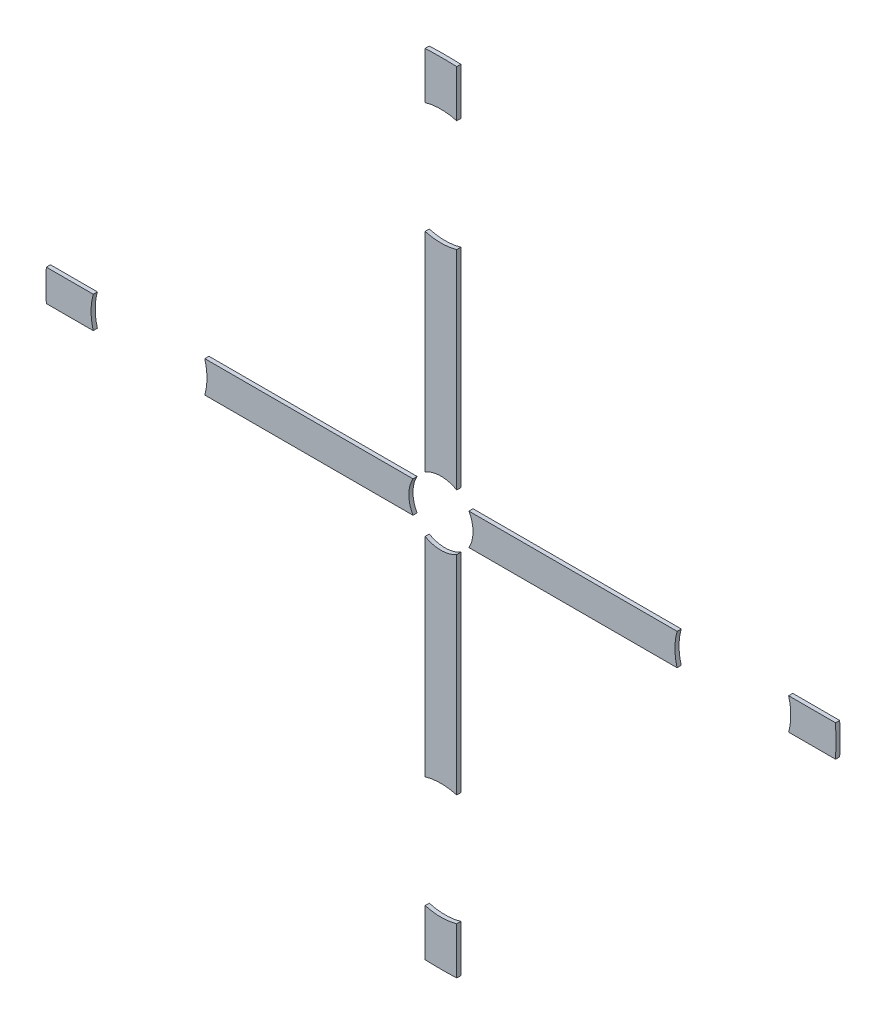
from build123d import *

# Parameters (mm, degrees)
BOSS_EXTRUDE1_DEPTH   = 6.096
BOSS_EXTRUDE1_2_DEPTH = 6.096
BOSS_EXTRUDE1_3_DEPTH = 6.096
BOSS_EXTRUDE1_4_DEPTH = 6.096
BOSS_EXTRUDE1_5_DEPTH = 6.096
BOSS_EXTRUDE1_6_DEPTH = 6.096
BOSS_EXTRUDE1_7_DEPTH = 6.096
BOSS_EXTRUDE1_8_DEPTH = 6.096


with BuildPart() as part:
    # Sketch1 → Boss-Extrude1 (new body)
    with BuildSketch(Plane.XY):
        with BuildLine():
            Line((-583.732686609, -23.362161365), (-514.280209998, -23.362161365))
            ThreePointArc((-514.280209998, -23.362161365), (-517.525, 0), (-514.280209998, 23.362161365))
            Line((-514.280209998, 23.362161365), (-583.732686609, 23.362161365))
            ThreePointArc((-583.732686609, 23.362161365), (-584.2, 0), (-583.732686609, -23.362161365))
        make_face()
    extrude(amount=BOSS_EXTRUDE1_DEPTH)


with BuildPart() as body_2:
    # Sketch1 → Boss-Extrude1 2 (new body)
    with BuildSketch(Plane.XY):
        with BuildLine():
            Line((-23.362161365, 583.732686609), (-23.362161365, 514.280209998))
            ThreePointArc((-23.362161365, 514.280209998), (0, 517.525), (23.362161365, 514.280209998))
            Line((23.362161365, 514.280209998), (23.362161365, 583.732686609))
            ThreePointArc((23.362161365, 583.732686609), (0, 584.2), (-23.362161365, 583.732686609))
        make_face()
    extrude(amount=BOSS_EXTRUDE1_2_DEPTH)


with BuildPart() as body_3:
    # Sketch1 → Boss-Extrude1 3 (new body)
    with BuildSketch(Plane.XY):
        with BuildLine():
            Line((583.732686609, 23.362161365), (514.280209998, 23.362161365))
            ThreePointArc((514.280209998, 23.362161365), (517.525, 0), (514.280209998, -23.362161365))
            Line((514.280209998, -23.362161365), (583.732686609, -23.362161365))
            ThreePointArc((583.732686609, -23.362161365), (584.2, 0), (583.732686609, 23.362161365))
        make_face()
    extrude(amount=BOSS_EXTRUDE1_3_DEPTH)


with BuildPart() as body_4:
    # Sketch1 → Boss-Extrude1 4 (new body)
    with BuildSketch(Plane.XY):
        with BuildLine():
            Line((23.362161365, -583.732686609), (23.362161365, -514.280209998))
            ThreePointArc((23.362161365, -514.280209998), (0, -517.525), (-23.362161365, -514.280209998))
            Line((-23.362161365, -514.280209998), (-23.362161365, -583.732686609))
            ThreePointArc((-23.362161365, -583.732686609), (0, -584.2), (23.362161365, -583.732686609))
        make_face()
    extrude(amount=BOSS_EXTRUDE1_4_DEPTH)


with BuildPart() as body_5:
    # Sketch1 → Boss-Extrude1 5 (new body)
    with BuildSketch(Plane.XY):
        with BuildLine():
            Line((-23.362161365, -41.357700811), (-23.362161365, -349.319790002))
            ThreePointArc((-23.362161365, -349.319790002), (0, -346.075), (23.362161365, -349.319790002))
            Line((23.362161365, -349.319790002), (23.362161365, -41.357700811))
            ThreePointArc((23.362161365, -41.357700811), (0, -47.5), (-23.362161365, -41.357700811))
        make_face()
    extrude(amount=BOSS_EXTRUDE1_5_DEPTH)


with BuildPart() as body_6:
    # Sketch1 → Boss-Extrude1 6 (new body)
    with BuildSketch(Plane.XY):
        with BuildLine():
            Line((41.357700811, -23.362161365), (349.319790002, -23.362161365))
            ThreePointArc((349.319790002, -23.362161365), (346.075, 0), (349.319790002, 23.362161365))
            Line((349.319790002, 23.362161365), (41.357700811, 23.362161365))
            ThreePointArc((41.357700811, 23.362161365), (47.5, 0), (41.357700811, -23.362161365))
        make_face()
    extrude(amount=BOSS_EXTRUDE1_6_DEPTH)


with BuildPart() as body_7:
    # Sketch1 → Boss-Extrude1 7 (new body)
    with BuildSketch(Plane.XY):
        with BuildLine():
            Line((-23.362161365, 349.319790002), (-23.362161365, 41.357700811))
            ThreePointArc((-23.362161365, 41.357700811), (0, 47.5), (23.362161365, 41.357700811))
            Line((23.362161365, 41.357700811), (23.362161365, 349.319790002))
            ThreePointArc((23.362161365, 349.319790002), (0, 346.075), (-23.362161365, 349.319790002))
        make_face()
    extrude(amount=BOSS_EXTRUDE1_7_DEPTH)


with BuildPart() as body_8:
    # Sketch1 → Boss-Extrude1 8 (new body)
    with BuildSketch(Plane.XY):
        with BuildLine():
            Line((-41.357700811, 23.362161365), (-349.319790002, 23.362161365))
            ThreePointArc((-349.319790002, 23.362161365), (-346.075, 0), (-349.319790002, -23.362161365))
            Line((-349.319790002, -23.362161365), (-41.357700811, -23.362161365))
            ThreePointArc((-41.357700811, -23.362161365), (-47.5, 0), (-41.357700811, 23.362161365))
        make_face()
    extrude(amount=BOSS_EXTRUDE1_8_DEPTH)


solid = Compound([part.part, body_2.part, body_3.part, body_4.part, body_5.part, body_6.part, body_7.part, body_8.part])
